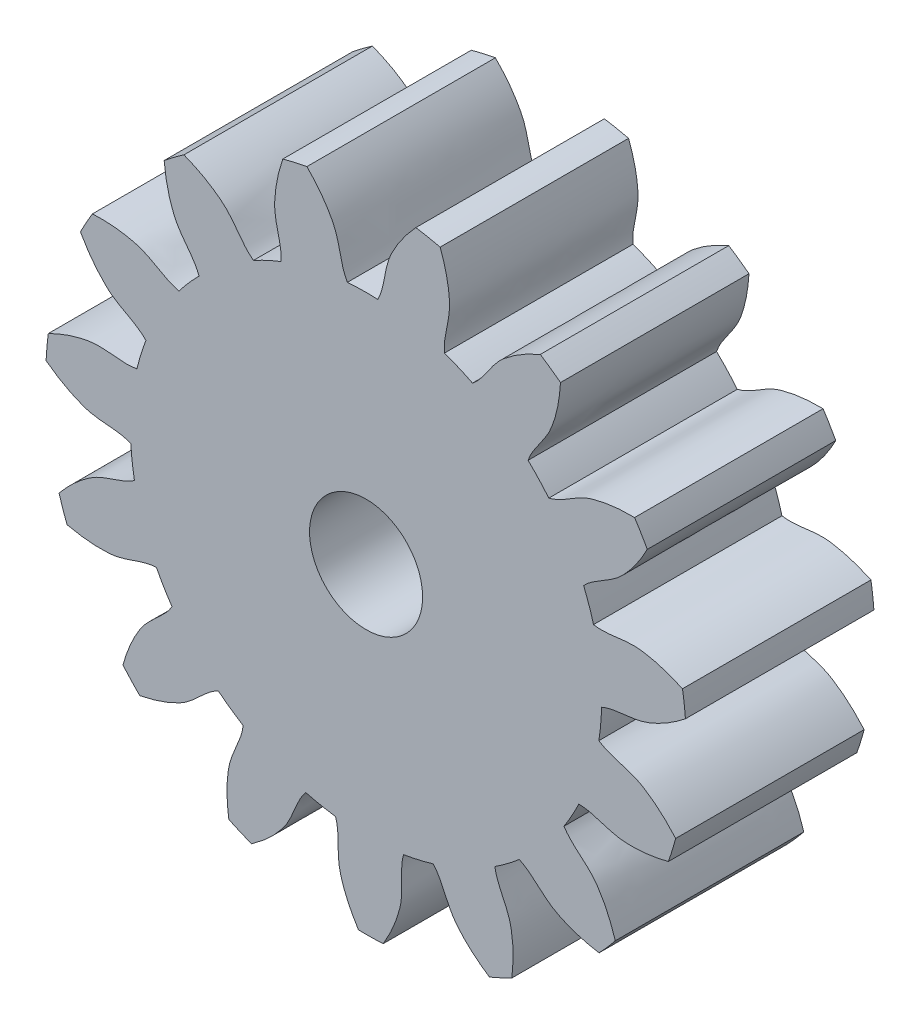
from build123d import *

# Parameters (mm, degrees)
SKETCH_1_R               = 6.25
SKETCH_1_R_2             = 1.5
EXTRUDE_1_DEPTH          = 5
EXTRUDE_2_DEPTH          = 5
PATTERN_CIRCULAR_1_COUNT = 15


with BuildPart() as part:
    # 草图1 → 凸台-拉伸1 (new body)
    with BuildSketch(Plane.XY):
        Circle(SKETCH_1_R)
        Circle(SKETCH_1_R_2, mode=Mode.SUBTRACT)
    extrude(amount=EXTRUDE_1_DEPTH)

    # 草图2 → 凸台-拉伸2 (add)
    with BuildSketch(Plane.XY):
        with BuildLine():
            ThreePointArc((8.393808384, 1.339395689), (8.439255267, 1.014381847), (8.47212218, 0.687855917))
            add(Edge.make_bspline(
                [(8.47212218, 0.687855917), (8.295877015, 0.547577731), (8.021625033, 0.356821182), (7.632681348, 0.161674714), (7.090445059, -0.052126887), (6.591121859, -0.007793761), (6.24803767, -0.156605476)],
                knots=[0, 0, 0, 0, 0.280058137, 0.412638826, 0.54023552, 1, 1, 1, 1], degree=3))
            ThreePointArc((6.24803767, -0.156605476), (6.205334755, 0.745869005), (6.032959808, 1.632757163))
            add(Edge.make_bspline(
                [(8.393808384, 1.339395689), (8.189341262, 1.433913008), (7.877696934, 1.554245976), (7.453587446, 1.651665056), (6.876130931, 1.730881788), (6.401535987, 1.569485621), (6.032959808, 1.632757163)],
                knots=[0, 0, 0, 0, 0.280058137, 0.412638826, 0.54023552, 1, 1, 1, 1], degree=3))
        make_face()
    extrude_2 = extrude(amount=EXTRUDE_2_DEPTH)

    # 阵列(圆周)1: 凸台-拉伸2 ×15 about axis
    pattern_circular_1_axis = Axis((0, 0, 5), (0, 0, -1))
    for i in range(1, PATTERN_CIRCULAR_1_COUNT):
        add(extrude_2.rotate(pattern_circular_1_axis, i * 360 / PATTERN_CIRCULAR_1_COUNT))


solid = part.part
